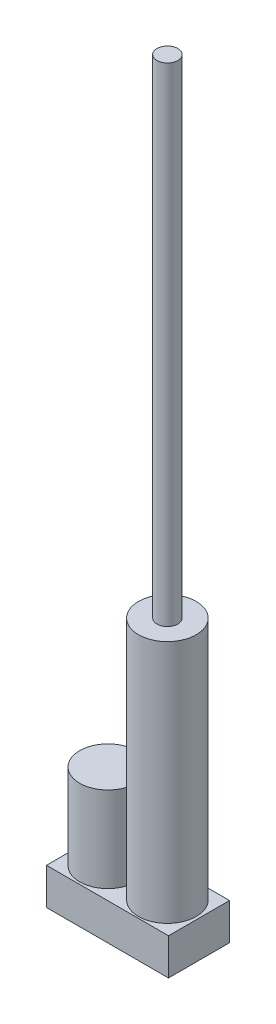
from build123d import *

# Parameters (mm, degrees)
SKETCH1_W           = 100
SKETCH1_H           = 50
BOSS_EXTRUDE1_DEPTH = 30
SKETCH3_R           = 23.162771803
BOSS_EXTRUDE2_DEPTH = 70
SKETCH4_R           = 23.656320331
BOSS_EXTRUDE3_DEPTH = 200
SKETCH5_R           = 8.525466093
BOSS_EXTRUDE4_DEPTH = 400


with BuildPart() as part:
    # Sketch1 → Boss-Extrude1 (new body)
    with BuildSketch(Plane(origin=(0, 0, 0), x_dir=(1, 0, 0), z_dir=(0, 1, 0))):
        Rectangle(SKETCH1_W, SKETCH1_H)
    extrude(amount=BOSS_EXTRUDE1_DEPTH)

    # Sketch3 → Boss-Extrude2 (add)
    with BuildSketch(Plane(origin=(0, 30, 0), x_dir=(1, 0, 0), z_dir=(0, 1, 0))):
        with Locations(Location((-24.62884077, 0, 0), (0, 0, 270))):
            Circle(SKETCH3_R)
    extrude(amount=BOSS_EXTRUDE2_DEPTH)

    # Sketch4 → Boss-Extrude3 (add)
    with BuildSketch(Plane(origin=(0, 30, 0), x_dir=(1, 0, 0), z_dir=(0, 1, 0))):
        with Locations(Location((24.089523089, 0, 0), (0, 0, 270))):
            Circle(SKETCH4_R)
    extrude(amount=BOSS_EXTRUDE3_DEPTH)

    # Sketch5 → Boss-Extrude4 (add)
    with BuildSketch(Plane(origin=(0, 230, 0), x_dir=(1, 0, 0), z_dir=(0, 1, 0))):
        with Locations(Location((24.089523089, 0, 0), (0, 0, 270))):
            Circle(SKETCH5_R)
    extrude(amount=BOSS_EXTRUDE4_DEPTH)


solid = part.part
